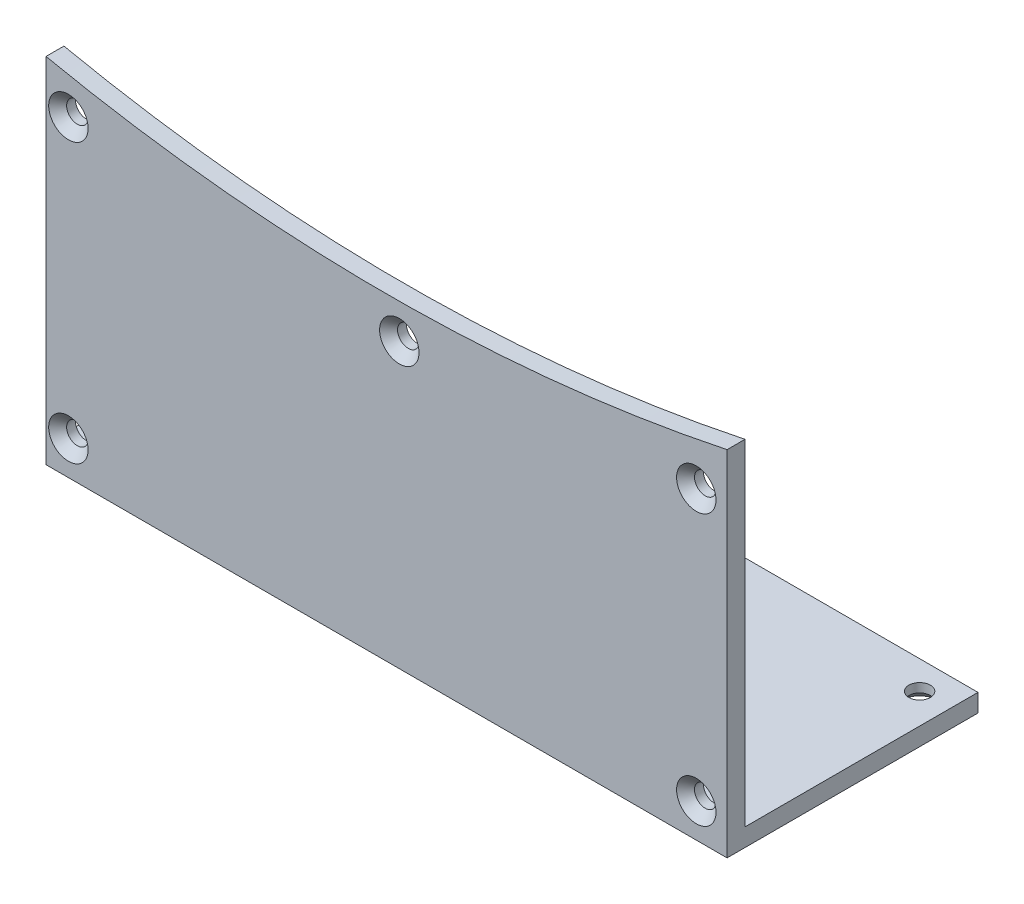
from build123d import *

# Parameters (mm, degrees)
BOSS_EXTRUDE1_DEPTH                                 = 2
SKETCH2_W                                           = 76
SKETCH2_H                                           = 2
BOSS_EXTRUDE2_DEPTH                                 = 26
CSK_FOR_M2_COUNTERSUNK_FLAT_HEAD_SCREW1_D           = 2.4
CSK_FOR_M2_COUNTERSUNK_FLAT_HEAD_SCREW1_CSINK_D     = 4.4
CSK_FOR_M2_COUNTERSUNK_FLAT_HEAD_SCREW1_CSINK_ANGLE = 90
CSK_FOR_M2_COUNTERSUNK_FLAT_HEAD_SCREW2_D           = 2.4
CSK_FOR_M2_COUNTERSUNK_FLAT_HEAD_SCREW2_CSINK_D     = 4.4
CSK_FOR_M2_COUNTERSUNK_FLAT_HEAD_SCREW2_CSINK_ANGLE = 90


with BuildPart() as part:
    # Sketch1 → Boss-Extrude1 (new body)
    with BuildSketch(Plane.XY):
        with BuildLine():
            Line((38, -220), (38, -180.544315889))
            ThreePointArc((38, -180.544315889), (0, -184.5), (-38, -180.544315889))
            Line((-38, -180.544315889), (-38, -220))
            Line((-38, -220), (38, -220))
        make_face()
    extrude(amount=-BOSS_EXTRUDE1_DEPTH)

    # Sketch2 → Boss-Extrude2 (add)
    with BuildSketch(Plane(origin=(0, 0, -2), x_dir=(-1, 0, 0), z_dir=(0, 0, -1))):
        with Locations((0, -219)):
            Rectangle(SKETCH2_W, SKETCH2_H)
    extrude(amount=BOSS_EXTRUDE2_DEPTH)

    # CSK for M2 Countersunk Flat Head Screw1 (through all)
    with Locations(Plane.XY):
        with Locations((-35.5, -216.217638504), (-35.5, -185.148473071), (1.425070676, -188.349538601), (34.565513804, -186.027196942), (34.565513804, -216.217638504)):
            CounterSinkHole(CSK_FOR_M2_COUNTERSUNK_FLAT_HEAD_SCREW1_D / 2, CSK_FOR_M2_COUNTERSUNK_FLAT_HEAD_SCREW1_CSINK_D / 2, counter_sink_angle=CSK_FOR_M2_COUNTERSUNK_FLAT_HEAD_SCREW1_CSINK_ANGLE)

    # CSK for M2 Countersunk Flat Head Screw2 (through all)
    with Locations(Plane(origin=(0, -220, 0), x_dir=(-1, 0, 0), z_dir=(0, -1, 0))):
        with Locations((-34.643963319, 24.841526038), (0, 25.688115944), (32.966559476, 23.505132472)):
            CounterSinkHole(CSK_FOR_M2_COUNTERSUNK_FLAT_HEAD_SCREW2_D / 2, CSK_FOR_M2_COUNTERSUNK_FLAT_HEAD_SCREW2_CSINK_D / 2, counter_sink_angle=CSK_FOR_M2_COUNTERSUNK_FLAT_HEAD_SCREW2_CSINK_ANGLE)


solid = part.part
